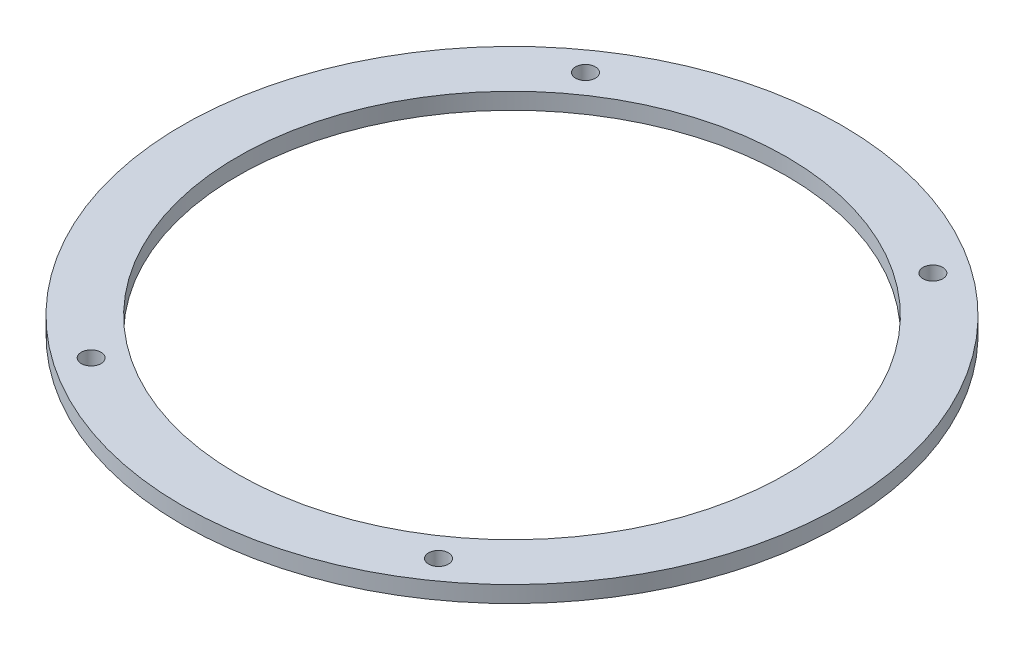
from build123d import *

# Parameters (mm, degrees)
SKETCH_2_R      = 60
SKETCH_2_R_2    = 50
EXTRUDE_2_DEPTH = 3
M3_HUB_BOARD_D  = 3.6


with BuildPart() as part:
    # ｽｹｯﾁ2 → ﾎﾞｽ - 押し出し2 (new body)
    with BuildSketch(Plane(origin=(0, 0, 0), x_dir=(1, 0, 0), z_dir=(0, 1, 0))):
        with Locations(Location((0, 0, 0), (0, 0, 270))):
            Circle(SKETCH_2_R)
        with Locations(Location((0, 0, 0), (0, 0, 270))):
            Circle(SKETCH_2_R_2, mode=Mode.SUBTRACT)
    extrude(amount=EXTRUDE_2_DEPTH)

    # M3 Hub_Boardへの固定用穴 (through all)
    with Locations(Plane(origin=(-31.622776602, 3, -45), x_dir=(0, 0, 1), z_dir=(0, 1, 0))):
        with Locations((0, 0), (0, 63.245553204)):
            m3_hub_board = Hole(M3_HUB_BOARD_D / 2)

    # ﾐﾗｰ1: M3 Hub_Boardへの固定用穴 across plane
    add(m3_hub_board.mirror(Plane.XY), mode=Mode.SUBTRACT)


solid = part.part
